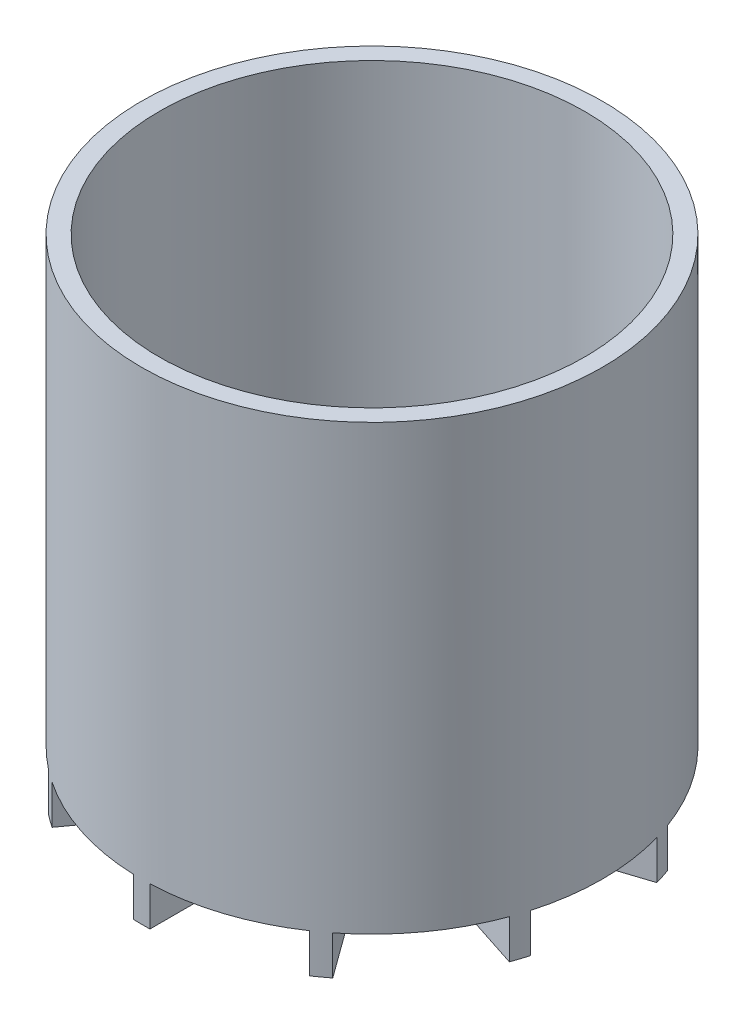
from build123d import *

# Parameters (mm, degrees)
SKETCH1_R               = 38.1
BOSS_EXTRUDE1_DEPTH     = 76.2
SHELL2_T                = 3.175
SKETCH2_W               = 3
SKETCH2_H               = 82.55
BOSS_EXTRUDE2_DEPTH     = 7
CUT_EXTRUDE1_DEPTH      = 99.527366122
CUT_EXTRUDE1_DEPTH_BACK = 99.527366122
SKETCH3_R               = 61.906276858
SKETCH3_R_2             = 41.275
SCALE1_SCALE            = 0.615384615


with BuildPart() as part:
    # Sketch1 → Boss-Extrude1 (new body)
    with BuildSketch(Plane(origin=(0, 0, 0), x_dir=(1, 0, 0), z_dir=(0, 1, 0))):
        Circle(SKETCH1_R)
    extrude(amount=BOSS_EXTRUDE1_DEPTH)

    # Shell2
    shell2_openings = [part.faces().sort_by_distance(p)[0] for p in [
        (0, 76.2, 0),
    ]]
    offset(amount=SHELL2_T, openings=shell2_openings, kind=Kind.INTERSECTION)

    # Sketch2 → Boss-Extrude2 (add)
    with BuildSketch(Plane(origin=(0, -3.175, 0), x_dir=(-1, 0, 0), z_dir=(0, -1, 0))):
        Rectangle(SKETCH2_W, SKETCH2_H)
        Polygon((-23.047310797, -34.273854321), (25.47436178, 32.510498564), (23.047310797, 34.273854321), (-25.47436178, -32.510498564), align=None)
        Polygon((-38.791332219, -14.181261217), (39.718383202, 11.328091668), (38.791332219, 14.181261217), (-39.718383202, -11.328091668), align=None)
        Polygon((-39.718383202, 11.328091668), (38.791332219, -14.181261217), (39.718383202, -11.328091668), (-38.791332219, 14.181261217), align=None)
        Polygon((-25.47436178, 32.510498564), (23.047310797, -34.273854321), (25.47436178, -32.510498564), (-23.047310797, 34.273854321), align=None)
    extrude(amount=BOSS_EXTRUDE2_DEPTH)

    # Sketch3 → Cut-Extrude1 (cut, two sides: drawn at the far end of the back side and taken through both)
    with BuildSketch(Plane.XZ.offset(3.175).offset(-CUT_EXTRUDE1_DEPTH_BACK)):
        Circle(SKETCH3_R)
        Circle(SKETCH3_R_2, mode=Mode.SUBTRACT)
    extrude(amount=CUT_EXTRUDE1_DEPTH + CUT_EXTRUDE1_DEPTH_BACK, mode=Mode.SUBTRACT)


with BuildPart() as part_1:
    # Scale1: scaled about (0, 25.92844449, 0)
    add(part.part.scale(SCALE1_SCALE).moved(Location((0, 9.97247865, 0))))


solid = part_1.part
